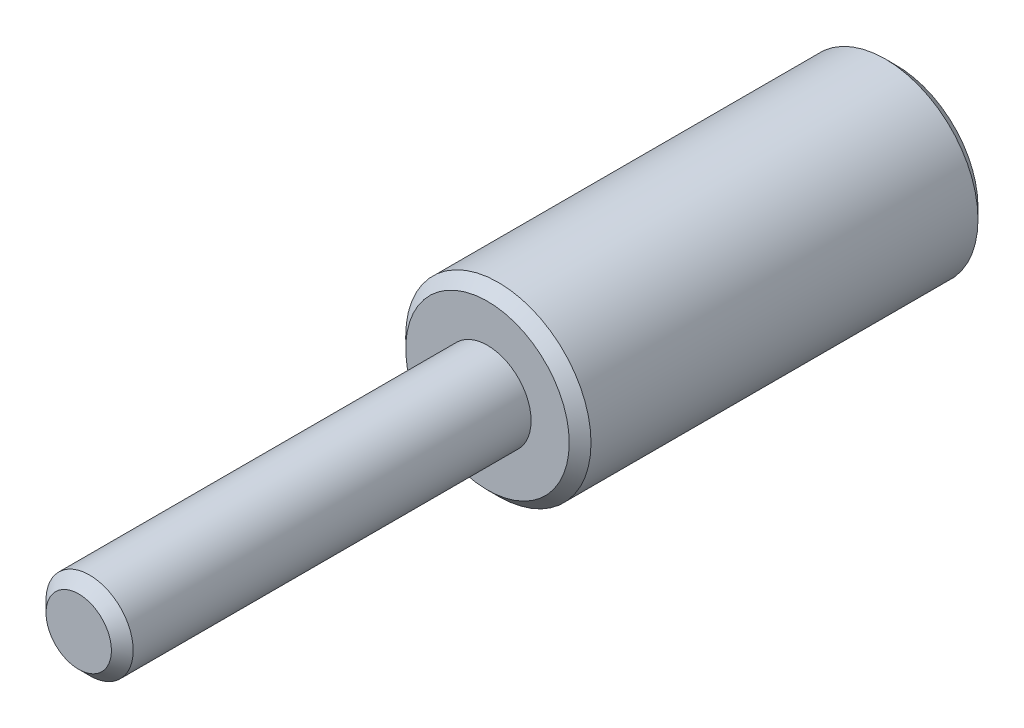
from build123d import *

# Parameters (mm, degrees)
SKETCH_1_R      = 17
EXTRUDE_1_DEPTH = 75
SKETCH_2_R      = 8
EXTRUDE_2_DEPTH = 75
CHAMFER_1_SIZE  = 2
CHAMFER_2_SIZE  = 2
CHAMFER_3_SIZE  = 2


with BuildPart() as part:
    # Эскиз1 → Бобышка-Вытянуть1 (new body)
    with BuildSketch(Plane.XY):
        Circle(SKETCH_1_R)
    extrude(amount=EXTRUDE_1_DEPTH)

    # Эскиз2 → Бобышка-Вытянуть2 (add)
    with BuildSketch(Plane.XY.offset(75)):
        Circle(SKETCH_2_R)
    extrude(amount=EXTRUDE_2_DEPTH)

    # Фаска1
    chamfer_1_edges = [part.edges().sort_by_distance(p)[0] for p in [
        (-8, 0, 150),
    ]]
    chamfer(chamfer_1_edges, length=CHAMFER_1_SIZE)

    # Фаска2
    chamfer_2_edges = [part.edges().sort_by_distance(p)[0] for p in [
        (-17, 0, 75),
    ]]
    chamfer(chamfer_2_edges, length=CHAMFER_2_SIZE)

    # Фаска3
    chamfer_3_edges = [part.edges().sort_by_distance(p)[0] for p in [
        (-17, 0, 0),
    ]]
    chamfer(chamfer_3_edges, length=CHAMFER_3_SIZE)


solid = part.part
